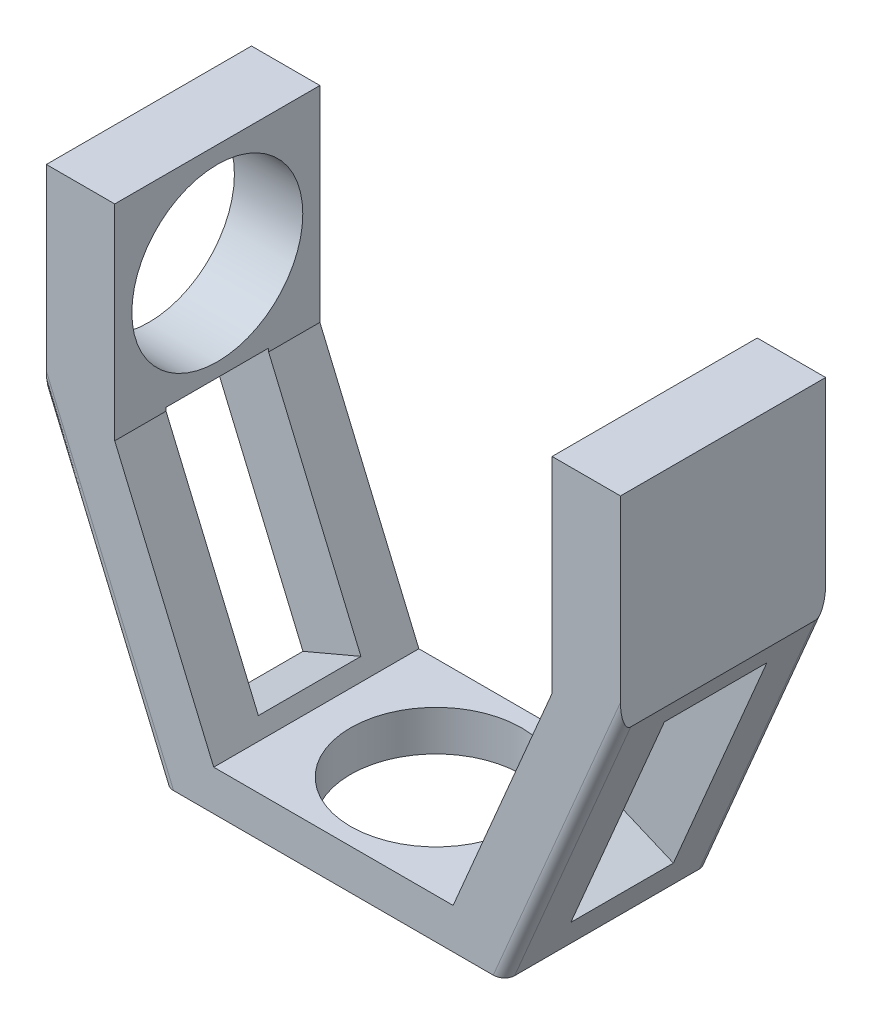
from build123d import *

# Parameters (mm, degrees)
EXTRUDE_2_DEPTH     = 60
CUT_EXTRUDE_2_DEPTH = 189.939286944
SKETCH_7_R          = 25
CUT_EXTRUDE_4_DEPTH = 20
SKETCH_8_R          = 25
CUT_EXTRUDE_5_DEPTH = 20
SKETCH_9_W          = 30
SKETCH_9_H          = 70
CUT_EXTRUDE_6_DEPTH = 20
SKETCH_10_W         = 30
SKETCH_10_H         = 70
CUT_EXTRUDE_7_DEPTH = 20
FILLET_1_R          = 3
FILLET_2_R          = 3
FILLET_3_R          = 3
FILLET_4_R          = 3


with BuildPart() as part:
    # 草图1 → 凸台-拉伸2 (new body)
    with BuildSketch(Plane.XY):
        Polygon((-161.784091828, 76.967277349), (-161.784091828, 16.967277349), (-127.826106531, -63.032722651), (-27.826106531, -63.032722651), (6.131878766, 16.967277349), (6.131878766, 76.967277349), align=None)
    extrude(amount=EXTRUDE_2_DEPTH)

    # 草图5 → 切除-拉伸2 (cut, through all)
    with BuildSketch(Plane.XY.offset(60)):
        Polygon((-141.784091828, 76.967277349), (-141.784091828, 16.967277349), (-112.836441026, -51.229114277), (-42.815772036, -51.229114277), (-13.868121234, 16.967277349), (-13.868121234, 76.967277349), align=None)
    extrude(amount=-CUT_EXTRUDE_2_DEPTH, mode=Mode.SUBTRACT)

    # 草图7 → 切除-拉伸4 (cut)
    with BuildSketch(Plane.ZY.offset(161.784091828)):
        with Locations(Location((30, 46.967277349, 0), (0, 0, 270))):
            Circle(SKETCH_7_R)
    extrude(amount=-CUT_EXTRUDE_4_DEPTH, mode=Mode.SUBTRACT)

    # 草图8 → 切除-拉伸5 (cut)
    with BuildSketch(Plane(origin=(0, -51.229114277, 0), x_dir=(1, 0, 0), z_dir=(0, 1, 0))):
        with Locations(Location((-77.815772036, -30, 0), (0, 0, 270))):
            Circle(SKETCH_8_R)
    extrude(amount=-CUT_EXTRUDE_5_DEPTH, mode=Mode.SUBTRACT)

    # 草图9 → 切除-拉伸6 (cut)
    with BuildSketch(Plane(origin=(-130.981763761, -55.598460099, 0), x_dir=(0, 0, 1), z_dir=(-0.9205048534524416, -0.3907311284892711, 0))):
        with Locations((30, 36.923711729)):
            Rectangle(SKETCH_9_W, SKETCH_9_H)
    extrude(amount=-CUT_EXTRUDE_6_DEPTH, mode=Mode.SUBTRACT)

    # 草图10 → 切除-拉伸7 (cut)
    with BuildSketch(Plane(origin=(-0.906899112, 0.384955834, 0), x_dir=(0, 0, -1), z_dir=(0.9205048534524416, -0.3907311284892711, 0))):
        with Locations((-29.473403637, -23.894453133)):
            Rectangle(SKETCH_10_W, SKETCH_10_H)
    extrude(amount=-CUT_EXTRUDE_7_DEPTH, mode=Mode.SUBTRACT)

    # 圆角1
    fillet_1_edges = [part.edges().sort_by_distance(p)[0] for p in [
        (-144.805099179, -23.032722651, 0),
    ]]
    fillet(fillet_1_edges, radius=FILLET_1_R)

    # 圆角2
    fillet_2_edges = [part.edges().sort_by_distance(p)[0] for p in [
        (-144.805099179, -23.032722651, 60),
    ]]
    fillet(fillet_2_edges, radius=FILLET_2_R)

    # 圆角3
    fillet_3_edges = [part.edges().sort_by_distance(p)[0] for p in [
        (-10.847113883, -23.032722651, 60),
    ]]
    fillet(fillet_3_edges, radius=FILLET_3_R)

    # 圆角4
    fillet_4_edges = [part.edges().sort_by_distance(p)[0] for p in [
        (-10.847113883, -23.032722651, 0),
    ]]
    fillet(fillet_4_edges, radius=FILLET_4_R)


solid = part.part
